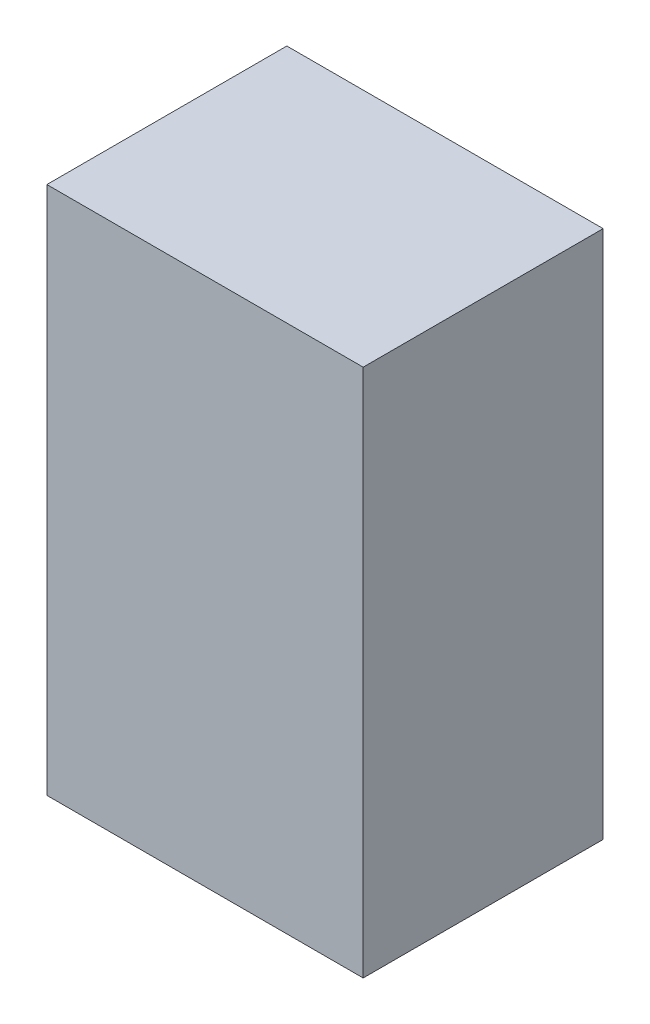
from build123d import *

# Parameters (mm, degrees)
ESQUISSE1_W        = 58
ESQUISSE1_H        = 44
BOSS_EXTRU_1_DEPTH = 97


with BuildPart() as part:
    # Esquisse1 → Boss.-Extru.1 (new body)
    with BuildSketch(Plane(origin=(0, 0, 0), x_dir=(1, 0, 0), z_dir=(0, 1, 0))):
        Rectangle(ESQUISSE1_W, ESQUISSE1_H)
    extrude(amount=BOSS_EXTRU_1_DEPTH)


solid = part.part
